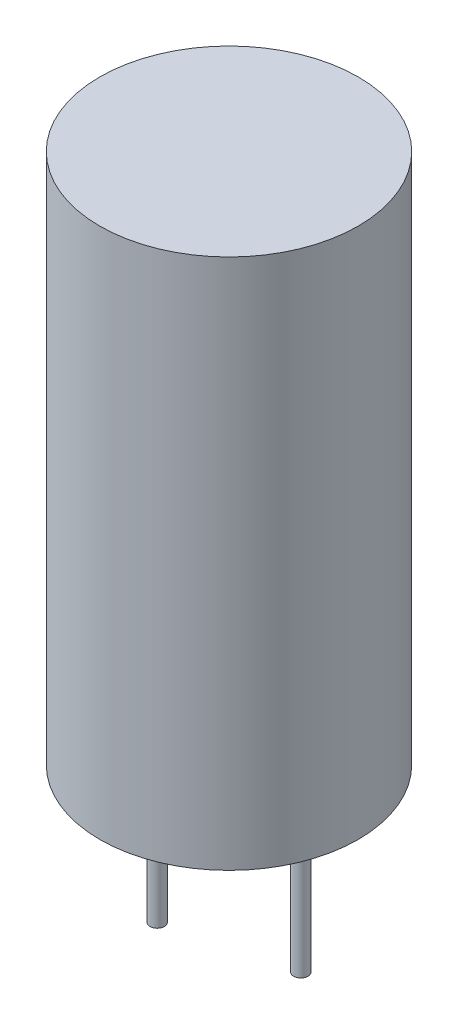
from build123d import *

# Parameters (mm, degrees)
SKETCH_1_R      = 9
EXTRUDE_1_DEPTH = 37
SKETCH_2_R      = 0.5
EXTRUDE_2_DEPTH = 12
SKETCH_3_R      = 0.5
EXTRUDE_3_DEPTH = 10


with BuildPart() as part:
    # 草图1 → 拉伸1 (new body)
    with BuildSketch(Plane(origin=(0, 0, 0), x_dir=(1, 0, 0), z_dir=(0, 1, 0))):
        with Locations(Location((0, 0, 0), (0, 0, 270))):
            Circle(SKETCH_1_R)
    extrude(amount=EXTRUDE_1_DEPTH)

    # 草图2 → 拉伸2 (add)
    with BuildSketch(Plane.XZ):
        with Locations(Location((-5, 0, 0), (0, 0, 90))):
            Circle(SKETCH_2_R)
    extrude(amount=EXTRUDE_2_DEPTH)

    # 草图3 → 拉伸3 (add)
    with BuildSketch(Plane.XZ):
        with Locations(Location((5, 0, 0), (0, 0, 90))):
            Circle(SKETCH_3_R)
    extrude(amount=EXTRUDE_3_DEPTH)


solid = part.part
